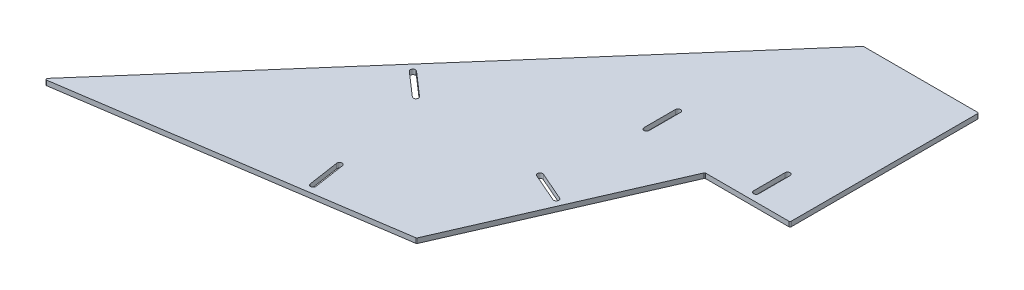
from build123d import *

# Parameters (mm, degrees)
BOSS_EXTRUDE1_DEPTH = 4
FILLET1_R           = 1


with BuildPart() as part:
    # Sketch2 → Boss-Extrude1 (new body)
    with BuildSketch(Plane(origin=(0, 0, 0), x_dir=(-1, 0, 0), z_dir=(0, 1, 0))):
        Polygon((-4.690238769, 155), (67.247234081, 320), (334.267832537, 360), (296.347290812, 316.561271604), (20, 0), (0, 0), (-74.690238769, 0), (-74.690238769, 155), align=None)
        with BuildLine():
            Line((-41.790238769, 147.9), (-41.790238769, 122.1))
            ThreePointArc((-41.790238769, 122.1), (-39.690238769, 120), (-37.590238769, 122.1))
            Line((-37.590238769, 122.1), (-37.590238769, 147.9))
            ThreePointArc((-37.590238769, 147.9), (-39.690238769, 150), (-41.790238769, 147.9))
        make_face(mode=Mode.SUBTRACT)
        with BuildLine():
            Line((36.947560473, 232.737466349), (60.597560473, 222.426428574))
            ThreePointArc((60.597560473, 222.426428574), (63.36183099, 223.512158057), (62.276101506, 226.276428574))
            Line((62.276101506, 226.276428574), (38.626101506, 236.587466349))
            ThreePointArc((38.626101506, 236.587466349), (35.86183099, 235.501736865), (36.947560473, 232.737466349))
        make_face(mode=Mode.SUBTRACT)
        with BuildLine():
            Line((48.209761231, 147.9), (48.209761231, 122.1))
            ThreePointArc((48.209761231, 122.1), (50.309761231, 120), (52.409761231, 122.1))
            Line((52.409761231, 122.1), (52.409761231, 147.9))
            ThreePointArc((52.409761231, 147.9), (50.309761231, 150), (48.209761231, 147.9))
        make_face(mode=Mode.SUBTRACT)
        with BuildLine():
            Line((145.339473414, 324.519087967), (149.161695636, 299.003786336))
            ThreePointArc((149.161695636, 299.003786336), (151.549633624, 297.23807057), (153.31534939, 299.626008558))
            Line((153.31534939, 299.626008558), (149.493127167, 325.141310189))
            ThreePointArc((149.493127167, 325.141310189), (147.105189179, 326.907025955), (145.339473414, 324.519087967))
        make_face(mode=Mode.SUBTRACT)
        with BuildLine():
            Line((166.710229804, 218.087105004), (186.146285223, 201.120085532))
            ThreePointArc((186.146285223, 201.120085532), (189.109326203, 201.321053574), (188.908358161, 204.284094554))
            Line((188.908358161, 204.284094554), (169.472302741, 221.251114025))
            ThreePointArc((169.472302741, 221.251114025), (166.509261762, 221.050145983), (166.710229804, 218.087105004))
        make_face(mode=Mode.SUBTRACT)
    extrude(amount=BOSS_EXTRUDE1_DEPTH)

    # Fillet1
    fillet1_edges = [part.edges().sort_by_distance(p)[0] for p in [
        (-20, 2, 0),
        (74.690238769, 2, 0),
        (74.690238769, 2, 155),
        (4.690238769, 2, 155),
        (-67.247234081, 2, 320),
        (-334.267832537, 2, 360),
    ]]
    fillet(fillet1_edges, radius=FILLET1_R)


solid = part.part
